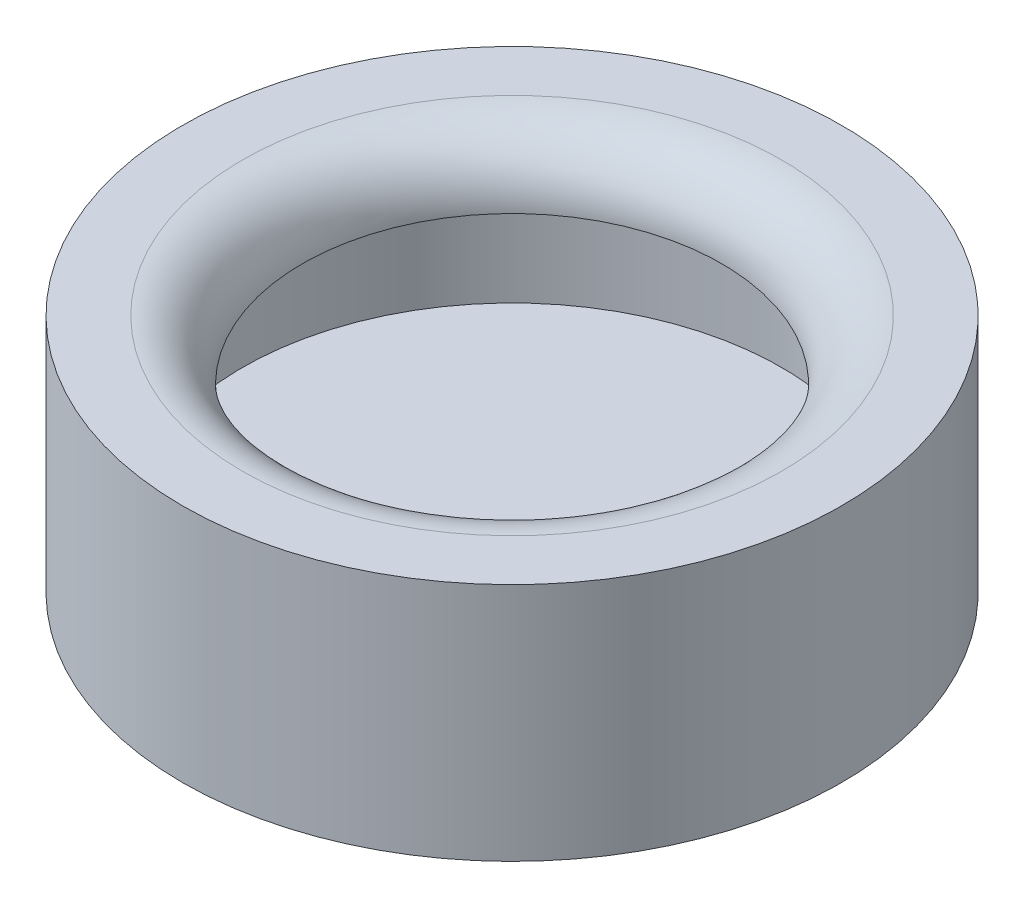
from build123d import *

# Parameters (mm, degrees)
SKETCH1_R           = 6.985
BOSS_EXTRUDE1_DEPTH = 5.08
SKETCH3_R           = 5.08
CUT_EXTRUDE1_DEPTH  = 3.81
SKETCH4_R           = 5.08
SKETCH4_R_2         = 4.445
BOSS_EXTRUDE4_DEPTH = 3.81
FILLET2_R           = 1.27
CUT_EXTRUDE2_START  = 2.54
SKETCH5_R           = 5.715
SKETCH5_R_2         = 4.445
CUT_EXTRUDE2_DEPTH  = 2.54


with BuildPart() as part:
    # Sketch1 → Boss-Extrude1 (new body)
    with BuildSketch(Plane(origin=(0, 0, 0), x_dir=(1, 0, 0), z_dir=(0, 1, 0))):
        with Locations(Location((0, 0, 0), (0, 0, 270))):
            Circle(SKETCH1_R)
    extrude(amount=BOSS_EXTRUDE1_DEPTH)

    # Sketch3 → Cut-Extrude1 (cut)
    with BuildSketch(Plane(origin=(0, 5.08, 0), x_dir=(1, 0, 0), z_dir=(0, 1, 0))):
        with Locations(Location((0, 0, 0), (0, 0, 270))):
            Circle(SKETCH3_R)
    extrude(amount=-CUT_EXTRUDE1_DEPTH, mode=Mode.SUBTRACT)

    # Sketch4 → Boss-Extrude4 (add)
    with BuildSketch(Plane(origin=(0, 5.08, 0), x_dir=(1, 0, 0), z_dir=(0, 1, 0))):
        Circle(SKETCH4_R)
        with Locations(Location((0, 0, 0), (0, 0, 270))):
            Circle(SKETCH4_R_2, mode=Mode.SUBTRACT)
    extrude(amount=-BOSS_EXTRUDE4_DEPTH)

    # Fillet2
    fillet2_edges = [part.edges().sort_by_distance(p)[0] for p in [
        (0, 5.08, -4.445),
    ]]
    fillet(fillet2_edges, radius=FILLET2_R)

    # Sketch5 → Cut-Extrude2 (cut)
    with BuildSketch(Plane(origin=(0, 1.27, 0), x_dir=(1, 0, 0), z_dir=(0, 1, 0)).offset(CUT_EXTRUDE2_START)):
        with Locations(Location((0, 0, 0), (0, 0, 270))):
            Circle(SKETCH5_R)
        Circle(SKETCH5_R_2, mode=Mode.SUBTRACT)
    extrude(amount=-CUT_EXTRUDE2_DEPTH, mode=Mode.SUBTRACT)


solid = part.part
